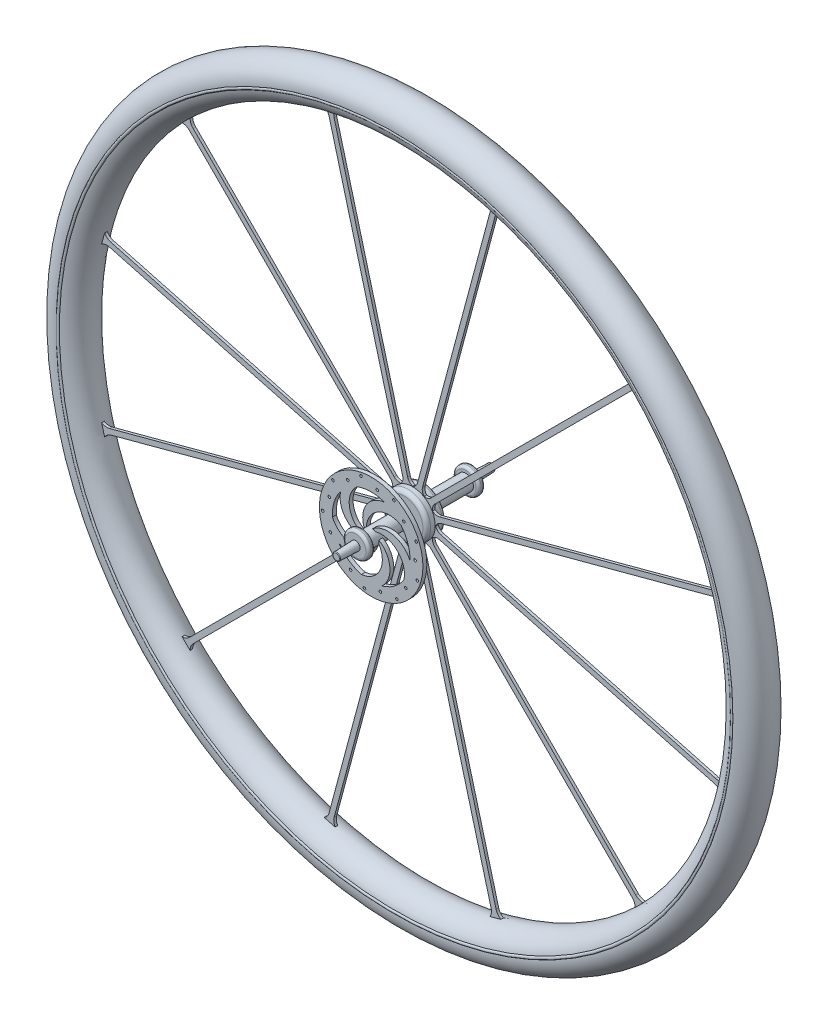
from build123d import *

# Parameters (mm, degrees)
SKETCH1_R                     = 10
BOSS_EXTRUDE1_DEPTH           = 45
SKETCH1_5_R                   = 5
BOSS_EXTRUDE2_DEPTH           = 60
BOSS_EXTRUDE2_TAPER           = 2
BOSS_EXTRUDE2_OTHER_WAY_DEPTH = 60
BOSS_EXTRUDE2_OTHER_WAY_TAPER = 2
SKETCH4_OUTSIDE_W             = 46.658
SKETCH4_OUTSIDE_H             = 46.658
SKETCH4_OUTSIDE_R             = 6
CUT_EXTRUDE1_DEPTH            = 40
FILLET3_R                     = 2
FILLET4_R                     = 2
FILLET5_R                     = 0.5
SKETCH5_R                     = 17.5
BOSS_EXTRUDE3_DEPTH           = 7.5
FILLET6_R                     = 3
FILLET7_R                     = 1
BOSS_EXTRUDE4_START           = 30
SKETCH6_R                     = 40
SKETCH6_R_2                   = 1
BOSS_EXTRUDE4_DEPTH           = 3
BOSS_EXTRUDE8_DEPTH           = 1
CIRPATTERN1_COUNT             = 12
SWEEP2_PROFILE_R              = 15


with BuildPart() as part:
    # Sketch1 → Boss-Extrude1 (new, symmetric)
    with BuildSketch(Plane.XY):
        with Locations(Location((0, 0, 0), (0, 0, 180))):
            Circle(SKETCH1_R)
    extrude(amount=BOSS_EXTRUDE1_DEPTH, both=True)

    # Sketch1<5> → Boss-Extrude2 (add)
    with BuildSketch(Plane.XY):
        Circle(SKETCH1_5_R)
    extrude(amount=BOSS_EXTRUDE2_DEPTH, taper=BOSS_EXTRUDE2_TAPER)

    # Sketch1<5> → Boss-Extrude2 other way (add)
    with BuildSketch(Plane.XY):
        Circle(SKETCH1_5_R)
    extrude(amount=-BOSS_EXTRUDE2_OTHER_WAY_DEPTH, taper=BOSS_EXTRUDE2_OTHER_WAY_TAPER)

    # Sketch4 outside → Cut-Extrude1 (cut, symmetric)
    with BuildSketch(Plane.XY):
        Rectangle(SKETCH4_OUTSIDE_W, SKETCH4_OUTSIDE_H)
        Circle(SKETCH4_OUTSIDE_R, mode=Mode.SUBTRACT)
    extrude(amount=CUT_EXTRUDE1_DEPTH, both=True, mode=Mode.SUBTRACT)

    # Fillet3
    fillet3_edges = [part.edges().sort_by_distance(p)[0] for p in [
        (10, 0, -40),
        (10, 0, -45),
    ]]
    fillet(fillet3_edges, radius=FILLET3_R)

    # Fillet4
    fillet4_edges = [part.edges().sort_by_distance(p)[0] for p in [
        (10, 0, 45),
        (10, 0, 40),
    ]]
    fillet(fillet4_edges, radius=FILLET4_R)

    # Fillet5
    fillet5_edges = [part.edges().sort_by_distance(p)[0] for p in [
        (-2.90475383, 0, -60),
        (-2.90475383, 0, 60),
    ]]
    fillet(fillet5_edges, radius=FILLET5_R)

    # Sketch5 → Boss-Extrude3 (add, symmetric)
    with BuildSketch(Plane.XY):
        Circle(SKETCH5_R)
    extrude(amount=BOSS_EXTRUDE3_DEPTH, both=True)

    # Fillet6
    fillet6_edges = [part.edges().sort_by_distance(p)[0] for p in [
        (-17.5, 0, -7.5),
        (-17.5, 0, 7.5),
    ]]
    fillet(fillet6_edges, radius=FILLET6_R)

    # Fillet7
    fillet7_edges = [part.edges().sort_by_distance(p)[0] for p in [
        (-6, 0, 7.5),
        (-6, 0, -7.5),
    ]]
    fillet(fillet7_edges, radius=FILLET7_R)

    # Sketch6 → Boss-Extrude4 (add)
    with BuildSketch(Plane.XY.offset(BOSS_EXTRUDE4_START)):
        Circle(SKETCH6_R)
        with Locations((-27.829963859, -25.134500424)):
            Circle(SKETCH6_R_2, mode=Mode.SUBTRACT)
        with Locations((-15.916629656, -30.044315609)):
            Circle(SKETCH6_R_2, mode=Mode.SUBTRACT)
        with Locations((-5.162843718, -37.142900328)):
            Circle(SKETCH6_R_2, mode=Mode.SUBTRACT)
        with Locations((-31.504959516, -12.784268689)):
            Circle(SKETCH6_R_2, mode=Mode.SUBTRACT)
        with Locations((-37.475134615, -1.365388434)):
            Circle(SKETCH6_R_2, mode=Mode.SUBTRACT)
        with Locations((7.119268114, -33.24629335)):
            Circle(SKETCH6_R_2, mode=Mode.SUBTRACT)
        with Locations((19.920028377, -31.77172437)):
            Circle(SKETCH6_R_2, mode=Mode.SUBTRACT)
        with Locations((26.823981211, -20.891960941)):
            Circle(SKETCH6_R_2, mode=Mode.SUBTRACT)
        with Locations((35.682097809, -11.534205476)):
            Circle(SKETCH6_R_2, mode=Mode.SUBTRACT)
        with Locations((-32.35176868, 10.457679632)):
            Circle(SKETCH6_R_2, mode=Mode.SUBTRACT)
        with Locations((-29.585273395, 23.04260398)):
            Circle(SKETCH6_R_2, mode=Mode.SUBTRACT)
        with Locations((-18.060825729, 28.806363429)):
            Circle(SKETCH6_R_2, mode=Mode.SUBTRACT)
        with Locations((-7.852133949, 36.668705901)):
            Circle(SKETCH6_R_2, mode=Mode.SUBTRACT)
        with BuildLine():
            ThreePointArc((-10.988413518, 27.915135113), (-0.354739854, 29.997902587), (10.325212752, 28.167179156))
            ThreePointArc((10.325212752, 28.167179156), (-3.757528665, 19.399381921), (-5.26423558, 2.878858066))
            ThreePointArc((-5.26423558, 2.878858066), (-4.598952731, 3.853522256), (-3.755770696, 4.679122405))
            ThreePointArc((-3.755770696, 4.679122405), (5.662140485, 19.42231461), (23.153264634, 19.07685343))
            ThreePointArc((23.153264634, 19.07685343), (28.420080087, 9.607239345), (29.979245493, -1.115723827))
            ThreePointArc((29.979245493, -1.115723827), (17.288768374, 9.568360816), (1.111218467, 5.896201618))
            ThreePointArc((1.111218467, 5.896201618), (2.243762902, 5.564667828), (3.289512882, 5.017878536))
            ThreePointArc((3.289512882, 5.017878536), (20.221416506, 0.61680968), (25.297918012, -16.124991295))
            ThreePointArc((25.297918012, -16.124991295), (17.919315311, -24.060302134), (8.20297992, -28.856734403))
            ThreePointArc((8.20297992, -28.856734403), (14.442575143, -13.48580972), (5.951006361, 0.765194939))
            ThreePointArc((5.951006361, 0.765194939), (5.987739063, 0.383380904), (6, 0))
            ThreePointArc((6, 0), (5.946965982, -0.795987193), (5.788801463, -1.577902919))
            ThreePointArc((5.788801463, -1.577902919), (6.835382216, -19.041105264), (-7.518291458, -29.042646118))
            ThreePointArc((-7.518291458, -29.042646118), (-17.34533417, -24.477323843), (-24.909525094, -16.718718839))
            ThreePointArc((-24.909525094, -16.718718839), (-8.36276605, -17.903049589), (2.566705732, -5.423285138))
            ThreePointArc((2.566705732, -5.423285138), (1.455587364, -5.820761585), (0.288163176, -5.99307617))
            ThreePointArc((0.288163176, -5.99307617), (-15.996917971, -12.384859916), (-29.94447767, -1.82435113))
            ThreePointArc((-29.94447767, -1.82435113), (-28.639321374, 8.932484045), (-23.597913072, 18.523997913))
            ThreePointArc((-23.597913072, 18.523997913), (-19.611048802, 2.421116572), (-4.364694979, -4.116969484))
            ThreePointArc((-4.364694979, -4.116969484), (-5.086072002, -3.183060098), (-5.610706826, -2.126021852))
            ThreePointArc((-5.610706826, -2.126021852), (-16.722021237, 11.386840889), (-10.988413518, 27.915135113))
        make_face(mode=Mode.SUBTRACT)
        with Locations((33.977455384, 1.23795218)):
            Circle(SKETCH6_R_2, mode=Mode.SUBTRACT)
        with Locations((34.748117113, 14.100296348)):
            Circle(SKETCH6_R_2, mode=Mode.SUBTRACT)
        with Locations((4.680978305, 33.67622963)):
            Circle(SKETCH6_R_2, mode=Mode.SUBTRACT)
        with Locations((17.555106238, 33.137112804)):
            Circle(SKETCH6_R_2, mode=Mode.SUBTRACT)
        with Locations((25.232500566, 22.788613718)):
            Circle(SKETCH6_R_2, mode=Mode.SUBTRACT)
    extrude(amount=BOSS_EXTRUDE4_DEPTH)

    # Sketch8 → Boss-Extrude8 (add, symmetric)
    with BuildSketch(Plane.XY):
        with BuildLine():
            ThreePointArc((-15.847816988, 7.422714915), (-12.374368671, 12.374368671), (-7.422714915, 15.847816988))
            ThreePointArc((-7.422714915, 15.847816988), (-11.004522471, 15.371626105), (-14.21028643, 17.038713554))
            Line((-14.21028643, 17.038713554), (-169.559468623, 172.387895748))
            ThreePointArc((-169.559468623, 172.387895748), (-171.900905928, 178.210074559), (-169.320882617, 183.930526857))
            ThreePointArc((-169.320882617, 183.930526857), (-176.776695297, 176.776695297), (-183.930526857, 169.320882617))
            ThreePointArc((-183.930526857, 169.320882617), (-178.210074559, 171.900905928), (-172.387895748, 169.559468623))
            Line((-172.387895748, 169.559468623), (-17.038713554, 14.21028643))
            ThreePointArc((-17.038713554, 14.21028643), (-15.371626105, 11.004522471), (-15.847816988, 7.422714915))
        make_face()
    boss_extrude8 = extrude(amount=BOSS_EXTRUDE8_DEPTH, both=True)

    # CirPattern1: Boss-Extrude8 ×12 about axis
    cirpattern1_axis = Axis((0, 0, 0), (0, 0, 1))
    for i in range(1, CIRPATTERN1_COUNT):
        add(boss_extrude8.rotate(cirpattern1_axis, i * 360 / CIRPATTERN1_COUNT))

    # Sketch28 → Revolve2 (revolve)
    with BuildSketch(Plane(origin=(-158.659775862, 199.629846274, 0), x_dir=(0, 0, 1), z_dir=(-0.7828621422498412, -0.6221951994607396, 0)), mode=Mode.PRIVATE) as revolve2_sk:
        with BuildLine():
            Line((-8.964478537, -3.194718874), (-12.581894268, 3.079745459))
            ThreePointArc((-12.581894268, 3.079745459), (-12.826148414, 3.380932745), (-13.152080767, 3.591032651))
            Line((-13.152080767, 3.591032651), (-14.580850557, 4.219111072))
            ThreePointArc((-14.580850557, 4.219111072), (-15.379303955, 5.224614361), (-15, 6.451273729))
            Line((-15, 6.451273729), (15, 6.451273729))
            ThreePointArc((15, 6.451273729), (15.379303955, 5.224614361), (14.580850557, 4.219111072))
            Line((14.580850557, 4.219111072), (13.152080767, 3.591032651))
            ThreePointArc((13.152080767, 3.591032651), (12.826148414, 3.380932745), (12.581894268, 3.079745459))
            Line((12.581894268, 3.079745459), (8.964478537, -3.194718874))
            ThreePointArc((8.964478537, -3.194718874), (7.134146046, -5.026742173), (4.632813431, -5.697384812))
            Line((4.632813431, -5.697384812), (0, -5.697384812))
            Line((0, -5.697384812), (-4.632813431, -5.697384812))
            ThreePointArc((-4.632813431, -5.697384812), (-7.134146046, -5.026742173), (-8.964478537, -3.194718874))
        make_face()
    revolve(revolve2_sk.sketch.rotate(Axis((0, 0, -59.517449748), (0, 0, -1)), 128.476617376), axis=Axis((0, 0, -59.517449748), (0, 0, -1)))

    # Sweep2: sweep along a path in Sketch30
    with BuildLine(Plane.XY) as sweep2_path:
        CenterArc((0, 0), 262.5, 0, 360)
    # Sweep2 profile (on start of the path) → Sweep2 (sweep)
    with BuildSketch(Plane(origin=(262.5, 0, 0), x_dir=(0, 0, 1), z_dir=(0, 1, 0))):
        Circle(SWEEP2_PROFILE_R)
    sweep(path=sweep2_path.line)


solid = part.part
